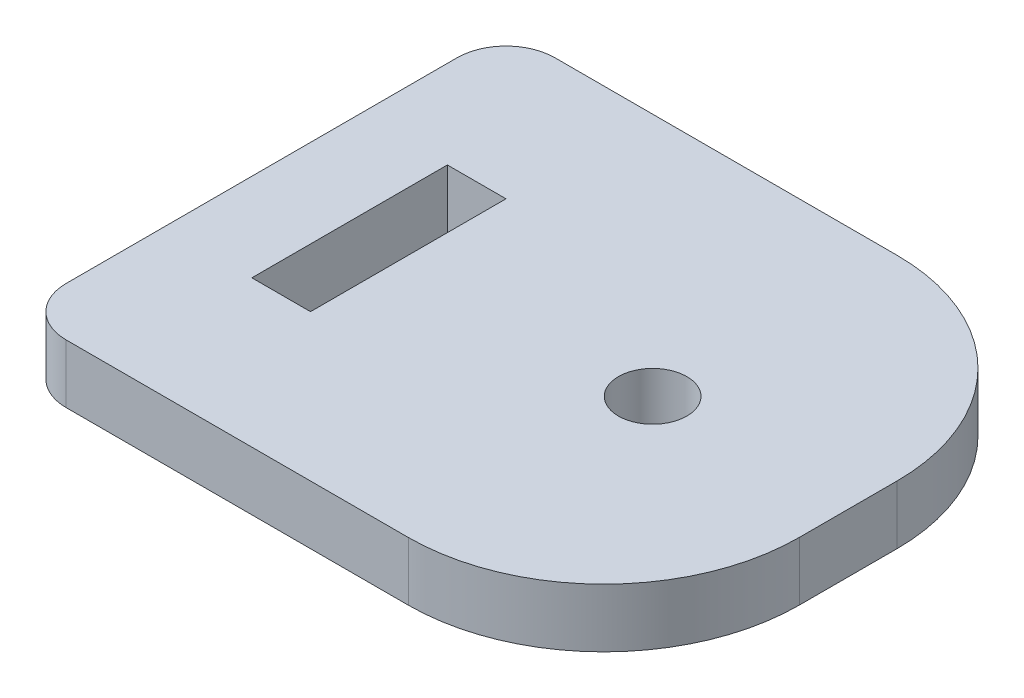
from build123d import *

# Parameters (mm, degrees)
SKETCH1_R           = 1.75
SKETCH1_W           = 3
SKETCH1_H           = 10
BOSS_EXTRUDE1_DEPTH = 3


with BuildPart() as part:
    # Sketch1 → Boss-Extrude1 (new body)
    with BuildSketch(Plane(origin=(0, 0, 0), x_dir=(1, 0, 0), z_dir=(0, 1, 0))):
        with BuildLine():
            Line((-12.5, -12.5), (5, -12.5))
            ThreePointArc((5, -12.5), (12.071067812, -9.571067812), (15, -2.5))
            Line((15, -2.5), (15, 2.5))
            ThreePointArc((15, 2.5), (12.071067812, 9.571067812), (5, 12.5))
            Line((5, 12.5), (-12.5, 12.5))
            ThreePointArc((-12.5, 12.5), (-14.267766953, 11.767766953), (-15, 10))
            Line((-15, 10), (-15, -10))
            ThreePointArc((-15, -10), (-14.267766953, -11.767766953), (-12.5, -12.5))
        make_face()
        with Locations(Location((5, 0, 0), (0, 0, 270))):
            Circle(SKETCH1_R, mode=Mode.SUBTRACT)
        with Locations((-9, 0)):
            Rectangle(SKETCH1_W, SKETCH1_H, mode=Mode.SUBTRACT)
    extrude(amount=BOSS_EXTRUDE1_DEPTH)


solid = part.part
